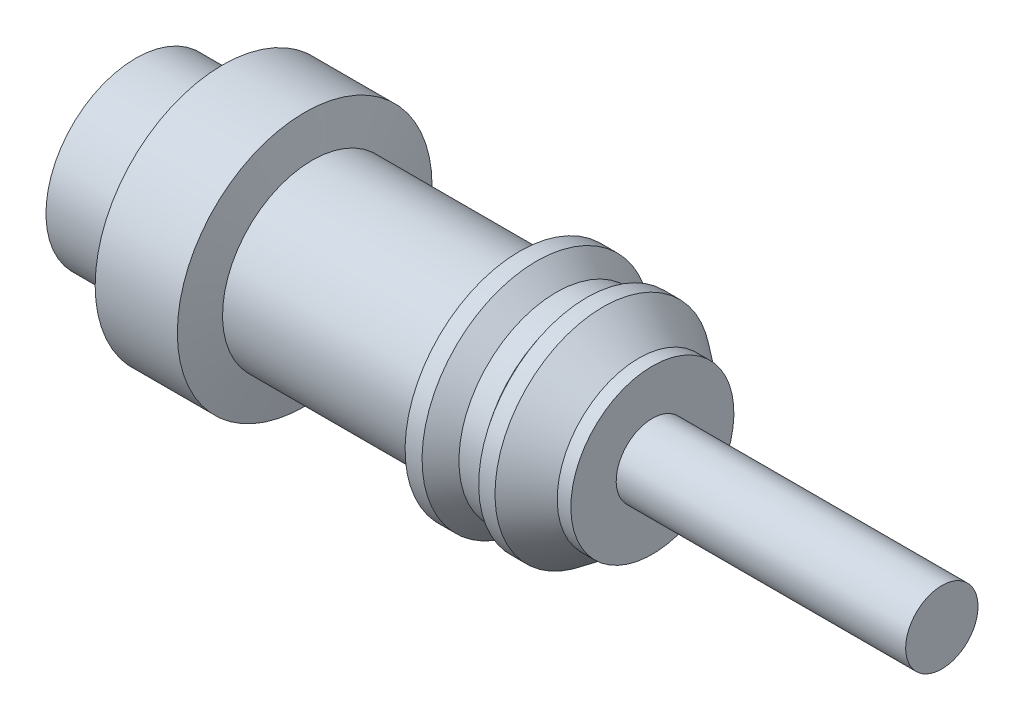
from build123d import *

# Parameters (mm, degrees)
SKETCH_2_R          = 5.2
CUT_EXTRUDE_1_DEPTH = 6
SKETCH_3_R          = 2.5
EXTRUDE_1_DEPTH     = 20


with BuildPart() as part:
    # 草图1 → 旋转1 (revolve)
    with BuildSketch(Plane.XY):
        Polygon((0, 0), (0, 6.2), (6, 6.2), (6, 8.8), (11.676949671, 8.8), (12.2, 6.2), (26.523039375, 6.2), (26.523039375, 7.91006879), (27.695766684, 7.91006879), (29.059190298, 6.725292283), (30.614076117, 6.725292283), (31.1695333, 7.470731504), (32.294644919, 7.470731504), (34.759713658, 5.633908195), (35.7, 5.633908195), (35.7, 0), align=None)
    revolve(axis=Axis((35.7, 0, 0), (-1, 0, 0)))

    # 草图2 → 切除-拉伸1 (cut)
    with BuildSketch(Plane.ZY):
        with Locations(Location((0, 0, 0), (0, 0, 270))):
            Circle(SKETCH_2_R)
    extrude(amount=-CUT_EXTRUDE_1_DEPTH, mode=Mode.SUBTRACT)

    # 草图3 → 凸台-拉伸1 (add)
    with BuildSketch(Plane(origin=(35.7, 0, 0), x_dir=(0, 0, -1), z_dir=(1, 0, 0))):
        with Locations(Location((0, 0, 0), (0, 0, 90))):
            Circle(SKETCH_3_R)
    extrude(amount=EXTRUDE_1_DEPTH)


solid = part.part
